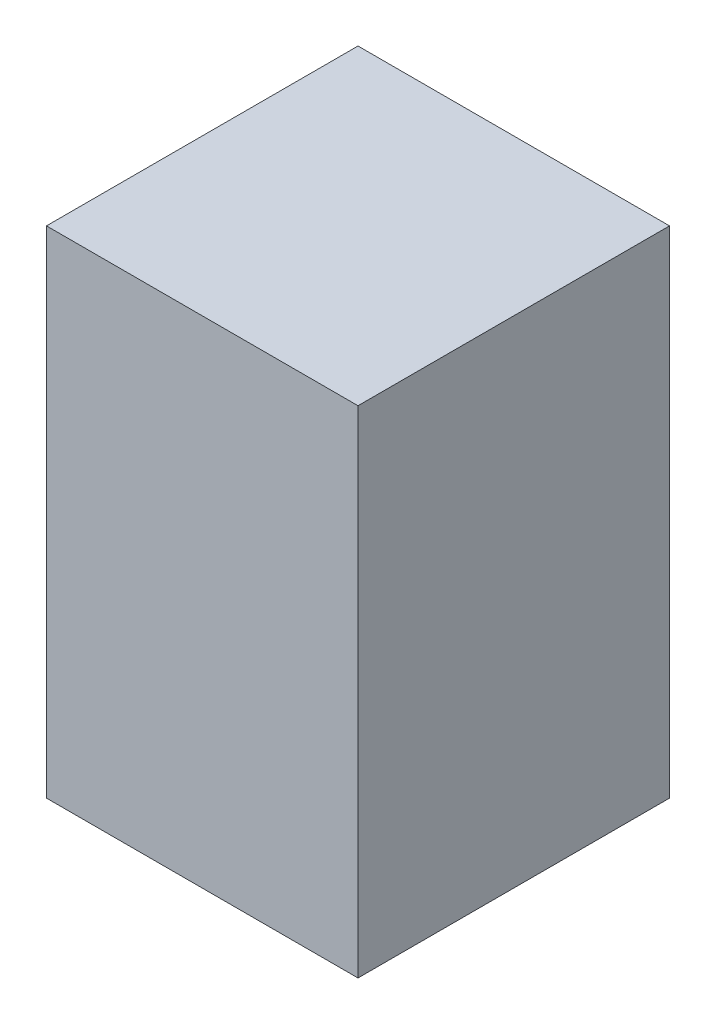
from build123d import *

# Parameters (mm, degrees)
SKETCH1_W           = 0.22
SKETCH1_H           = 0.22
BOSS_EXTRUDE1_DEPTH = 0.35


with BuildPart() as part:
    # Sketch1 → Boss-Extrude1 (new body)
    with BuildSketch(Plane(origin=(0, 0, 0), x_dir=(1, 0, 0), z_dir=(0, 1, 0))):
        Rectangle(SKETCH1_W, SKETCH1_H)
    extrude(amount=BOSS_EXTRUDE1_DEPTH)


solid = part.part
